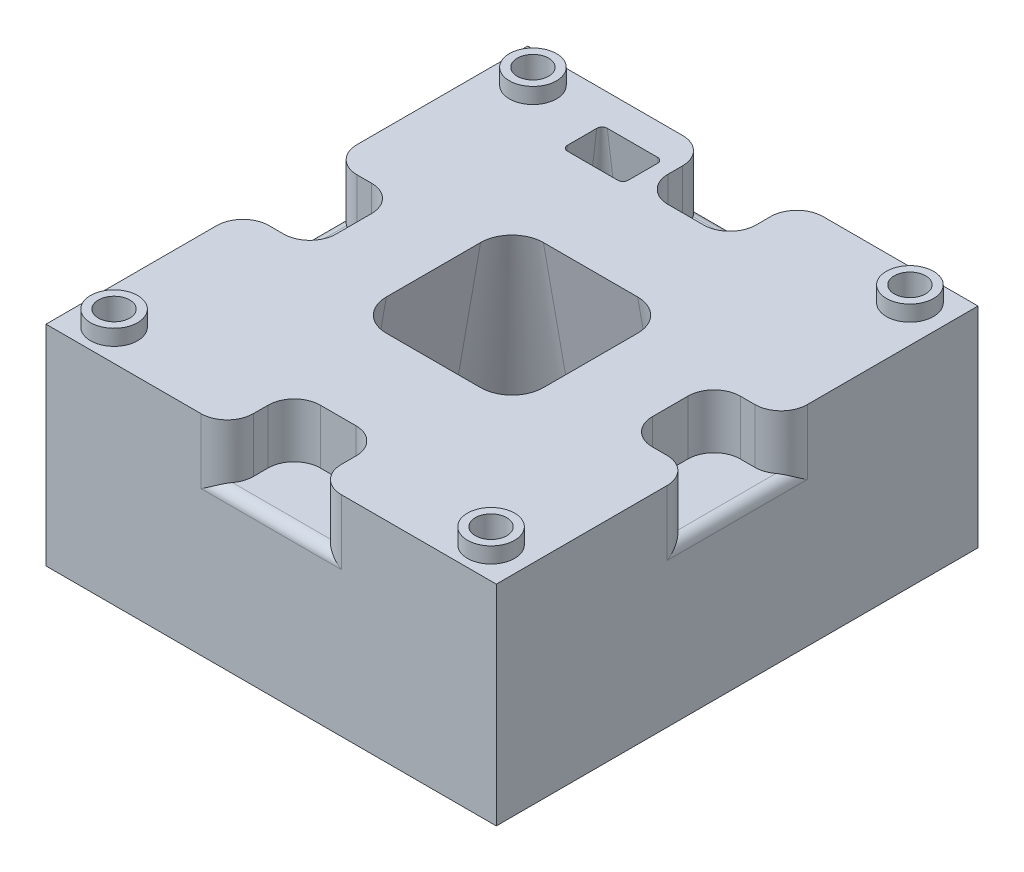
from build123d import *

# Parameters (mm, degrees)
ESQUISSE1_R             = 1.5
BOSS_EXTRU_1_DEPTH      = 20
ESQUISSE2_R             = 2.25
ESQUISSE2_R_2           = 1.5
BOSS_EXTRU_2_DEPTH      = 1.5
ESQUISSE6_W             = 7.215685205
ESQUISSE6_H             = 18.365547593
ESQUISSE6_W_2           = 15.795882497
ESQUISSE6_H_2           = 7.128539117
ESQUISSE6_W_3           = 6.98895005
ESQUISSE6_H_3           = 20.179428837
BOSS_EXTRU_3_DEPTH      = 14.8
ENL_V_MAT_EXTRU_1_DEPTH = 20
ENL_V_MAT_EXTRU_1_DRAFT = 10
ENL_V_MAT_EXTRU_2_DEPTH = 20
ENL_V_MAT_EXTRU_2_DRAFT = 7
ESQUISSE5_R             = 2.5
ENL_V_MAT_EXTRU_3_DEPTH = 18
CONG_4_R                = 1
CONG_5_R                = 1
CONG_6_R                = 1
CONG_7_R                = 1


with BuildPart() as part:
    # Esquisse1 → Boss.-Extru.1 (new body)
    with BuildSketch(Plane(origin=(0, 0, 0), x_dir=(1, 0, 0), z_dir=(0, 1, 0))):
        with BuildLine():
            Line((-19, 4.2), (-17.6, 4.2))
            ThreePointArc((-17.6, 4.2), (-15.832233047, 3.467766953), (-15.1, 1.7))
            Line((-15.1, 1.7), (-15.1, -1.7))
            ThreePointArc((-15.1, -1.7), (-15.832233047, -3.467766953), (-17.6, -4.2))
            Line((-17.6, -4.2), (-19, -4.2))
            ThreePointArc((-19, -4.2), (-20.767766953, -4.932233047), (-21.5, -6.7))
            Line((-21.5, -6.7), (-21.5, -20.5))
            Line((-21.5, -20.5), (-21.5, -23))
            Line((-21.5, -23), (-19, -23))
            Line((-19, -23), (-6.7, -23))
            ThreePointArc((-6.7, -23), (-4.932233047, -22.267766953), (-4.2, -20.5))
            Line((-4.2, -20.5), (-4.2, -19.1))
            ThreePointArc((-4.2, -19.1), (-3.467766953, -17.332233047), (-1.7, -16.6))
            Line((-1.7, -16.6), (1.7, -16.6))
            ThreePointArc((1.7, -16.6), (3.467766953, -17.332233047), (4.2, -19.1))
            Line((4.2, -19.1), (4.2, -20.5))
            ThreePointArc((4.2, -20.5), (4.932233047, -22.267766953), (6.7, -23))
            Line((6.7, -23), (19, -23))
            Line((19, -23), (21.5, -23))
            Line((21.5, -23), (21.5, -20.5))
            Line((21.5, -20.5), (21.5, -6.7))
            ThreePointArc((21.5, -6.7), (20.767766953, -4.932233047), (19, -4.2))
            Line((19, -4.2), (17.6, -4.2))
            ThreePointArc((17.6, -4.2), (15.832233047, -3.467766953), (15.1, -1.7))
            Line((15.1, -1.7), (15.1, 1.7))
            ThreePointArc((15.1, 1.7), (15.832233047, 3.467766953), (17.6, 4.2))
            Line((17.6, 4.2), (19, 4.2))
            ThreePointArc((19, 4.2), (20.767766953, 4.932233047), (21.5, 6.7))
            Line((21.5, 6.7), (21.5, 20.5))
            Line((21.5, 20.5), (21.5, 23))
            Line((21.5, 23), (19, 23))
            Line((19, 23), (6.7, 23))
            ThreePointArc((6.7, 23), (4.932233047, 22.267766953), (4.2, 20.5))
            Line((4.2, 20.5), (4.2, 19.1))
            ThreePointArc((4.2, 19.1), (3.467766953, 17.332233047), (1.7, 16.6))
            Line((1.7, 16.6), (-1.7, 16.6))
            ThreePointArc((-1.7, 16.6), (-3.467766953, 17.332233047), (-4.2, 19.1))
            Line((-4.2, 19.1), (-4.2, 20.5))
            ThreePointArc((-4.2, 20.5), (-4.932233047, 22.267766953), (-6.7, 23))
            Line((-6.7, 23), (-19, 23))
            Line((-19, 23), (-21.5, 23))
            Line((-21.5, 23), (-21.5, 20.5))
            Line((-21.5, 20.5), (-21.5, 6.7))
            ThreePointArc((-21.5, 6.7), (-20.767766953, 4.932233047), (-19, 4.2))
        make_face()
        with Locations(Location((-18, 20, 0), (0, 0, 270))):
            Circle(ESQUISSE1_R, mode=Mode.SUBTRACT)
        with Locations(Location((18, 20, 0), (0, 0, 270))):
            Circle(ESQUISSE1_R, mode=Mode.SUBTRACT)
        with Locations(Location((18, -20, 0), (0, 0, 270))):
            Circle(ESQUISSE1_R, mode=Mode.SUBTRACT)
        with Locations(Location((-18, -20, 0), (0, 0, 270))):
            Circle(ESQUISSE1_R, mode=Mode.SUBTRACT)
    extrude(amount=BOSS_EXTRU_1_DEPTH)

    # Esquisse2 → Boss.-Extru.2 (add)
    # profile 1 of 4: a face of its own
    with BuildSketch(Plane(origin=(0, 20, 0), x_dir=(1, 0, 0), z_dir=(0, 1, 0))):
        with Locations(Location((-18, 20, 0), (0, 0, 270))):
            Circle(ESQUISSE2_R)
        with Locations(Location((-18, 20, 0), (0, 0, 270))):
            Circle(ESQUISSE2_R_2, mode=Mode.SUBTRACT)
    # profile 2 of 4: a face of its own
    with BuildSketch(Plane(origin=(0, 20, 0), x_dir=(1, 0, 0), z_dir=(0, 1, 0))):
        with Locations(Location((18, 20, 0), (0, 0, 270))):
            Circle(ESQUISSE2_R)
        with Locations(Location((18, 20, 0), (0, 0, 270))):
            Circle(ESQUISSE2_R_2, mode=Mode.SUBTRACT)
    # profile 3 of 4: a face of its own
    with BuildSketch(Plane(origin=(0, 20, 0), x_dir=(1, 0, 0), z_dir=(0, 1, 0))):
        with Locations(Location((18, -20, 0), (0, 0, 270))):
            Circle(ESQUISSE2_R)
        with Locations(Location((18, -20, 0), (0, 0, 270))):
            Circle(ESQUISSE2_R_2, mode=Mode.SUBTRACT)
    # profile 4 of 4: a face of its own
    with BuildSketch(Plane(origin=(0, 20, 0), x_dir=(1, 0, 0), z_dir=(0, 1, 0))):
        with Locations(Location((-18, -20, 0), (0, 0, 270))):
            Circle(ESQUISSE2_R)
        with Locations(Location((-18, -20, 0), (0, 0, 270))):
            Circle(ESQUISSE2_R_2, mode=Mode.SUBTRACT)
    extrude(amount=BOSS_EXTRU_2_DEPTH)

    # Esquisse6 → Boss.-Extru.3 (add)
    with BuildSketch(Plane.XZ):
        with Locations((-17.892157398, 0.340102734)):
            Rectangle(ESQUISSE6_W, ESQUISSE6_H)
        with Locations((-0.491259504, 19.435730441)):
            Rectangle(ESQUISSE6_W_2, ESQUISSE6_H_2)
        with Locations((18.005524975, 1.247043355)):
            Rectangle(ESQUISSE6_W_3, ESQUISSE6_H_3)
        with BuildLine():
            Line((-4.2, -19.1), (-4.2, -20.5))
            ThreePointArc((-4.2, -20.5), (-4.932233047, -22.267766953), (-6.7, -23))
            Line((-6.7, -23), (8.691514293, -23))
            Line((8.691514293, -23), (8.691514293, -16.6))
            Line((8.691514293, -16.6), (-1.7, -16.6))
            ThreePointArc((-1.7, -16.6), (-3.467766953, -17.332233047), (-4.2, -19.1))
        make_face()
    extrude(amount=-BOSS_EXTRU_3_DEPTH)


with BuildPart() as enl_v_mat_extru_1_tool:
    # Esquisse3 → Enlèv. mat.-Extru.1 (with draft: the straight prism first)
    with BuildSketch(Plane(origin=(0, 20, 0), x_dir=(1, 0, 0), z_dir=(0, 1, 0))):
        with BuildLine():
            ThreePointArc((-4.5, 7.5), (-6.621320344, 6.621320344), (-7.5, 4.5))
            Line((-7.5, 4.5), (-7.5, -4.5))
            ThreePointArc((-7.5, -4.5), (-6.621320344, -6.621320344), (-4.5, -7.5))
            Line((-4.5, -7.5), (4.5, -7.5))
            ThreePointArc((4.5, -7.5), (6.621320344, -6.621320344), (7.5, -4.5))
            Line((7.5, -4.5), (7.5, 4.5))
            ThreePointArc((7.5, 4.5), (6.621320344, 6.621320344), (4.5, 7.5))
            Line((4.5, 7.5), (-4.5, 7.5))
        make_face()
    extrude(amount=-ENL_V_MAT_EXTRU_1_DEPTH)
    # Enlèv. mat.-Extru.1: the draft: its side faces are tilted about the plane it starts from
    enl_v_mat_extru_1_sides = [enl_v_mat_extru_1_tool.faces().sort_by_distance(p)[0] for p in [
        (-6.621320344, 10, -6.621320344),
        (-7.5, 10, 0),
        (-6.621320344, 10, 6.621320344),
        (0, 10, 7.5),
        (6.621320344, 10, 6.621320344),
        (7.5, 10, 0),
        (6.621320344, 10, -6.621320344),
        (0, 10, -7.5),
    ]]
    draft(enl_v_mat_extru_1_sides, Plane(origin=(0, 20, 0), x_dir=(1, 0, 0), z_dir=(0, 1, 0)), ENL_V_MAT_EXTRU_1_DRAFT)


with BuildPart() as part_1:
    add(part.part)

    # Enlèv. mat.-Extru.1: cut by enl_v_mat_extru_1_tool
    add(enl_v_mat_extru_1_tool.part, mode=Mode.SUBTRACT)


with BuildPart() as enl_v_mat_extru_2_tool:
    # Esquisse4 → Enlèv. mat.-Extru.2 (with draft: the straight prism first)
    with BuildSketch(Plane(origin=(0, 20, 0), x_dir=(1, 0, 0), z_dir=(0, 1, 0))):
        with BuildLine():
            ThreePointArc((-10.9, 20), (-11.253553391, 19.853553391), (-11.4, 19.5))
            Line((-11.4, 19.5), (-11.4, 16.7))
            ThreePointArc((-11.4, 16.7), (-11.253553391, 16.346446609), (-10.9, 16.2))
            Line((-10.9, 16.2), (-6.1, 16.2))
            ThreePointArc((-6.1, 16.2), (-5.746446609, 16.346446609), (-5.6, 16.7))
            Line((-5.6, 16.7), (-5.6, 19.5))
            ThreePointArc((-5.6, 19.5), (-5.746446609, 19.853553391), (-6.1, 20))
            Line((-6.1, 20), (-10.9, 20))
        make_face()
    extrude(amount=-ENL_V_MAT_EXTRU_2_DEPTH)
    # Enlèv. mat.-Extru.2: the draft: its side faces are tilted about the plane it starts from
    enl_v_mat_extru_2_sides = [enl_v_mat_extru_2_tool.faces().sort_by_distance(p)[0] for p in [
        (-5.746446609, 10, -19.853553391),
        (-8.5, 10, -20),
        (-11.253553391, 10, -19.853553391),
        (-11.4, 10, -18.1),
        (-11.253553391, 10, -16.346446609),
        (-8.5, 10, -16.2),
        (-5.746446609, 10, -16.346446609),
        (-5.6, 10, -18.1),
    ]]
    draft(enl_v_mat_extru_2_sides, Plane(origin=(0, 20, 0), x_dir=(1, 0, 0), z_dir=(0, 1, 0)), ENL_V_MAT_EXTRU_2_DRAFT)


with BuildPart() as part_2:
    add(part_1.part)

    # Enlèv. mat.-Extru.2: cut by enl_v_mat_extru_2_tool
    add(enl_v_mat_extru_2_tool.part, mode=Mode.SUBTRACT)

    # Esquisse5 → Enlèv. mat.-Extru.3 (cut)
    with BuildSketch(Plane.XZ):
        with Locations(Location((-18, 20, 0), (0, 0, 270))):
            Circle(ESQUISSE5_R)
        with Locations(Location((18, 20, 0), (0, 0, 270))):
            Circle(ESQUISSE5_R)
        with Locations(Location((18, -20, 0), (0, 0, 270))):
            Circle(ESQUISSE5_R)
        with Locations(Location((-18, -20, 0), (0, 0, 270))):
            Circle(ESQUISSE5_R)
    extrude(amount=-ENL_V_MAT_EXTRU_3_DEPTH, mode=Mode.SUBTRACT)

    # Congé4
    cong_4_edges = [part_2.edges().sort_by_distance(p)[0] for p in [
        (-21.5, 14.8, 0),
    ]]
    fillet(cong_4_edges, radius=CONG_4_R)

    # Congé5
    cong_5_edges = [part_2.edges().sort_by_distance(p)[0] for p in [
        (0, 14.8, 23),
    ]]
    fillet(cong_5_edges, radius=CONG_5_R)

    # Congé6
    cong_6_edges = [part_2.edges().sort_by_distance(p)[0] for p in [
        (21.5, 14.8, 0),
    ]]
    fillet(cong_6_edges, radius=CONG_6_R)

    # Congé7
    cong_7_edges = [part_2.edges().sort_by_distance(p)[0] for p in [
        (0, 14.8, -23),
    ]]
    fillet(cong_7_edges, radius=CONG_7_R)


solid = part_2.part
